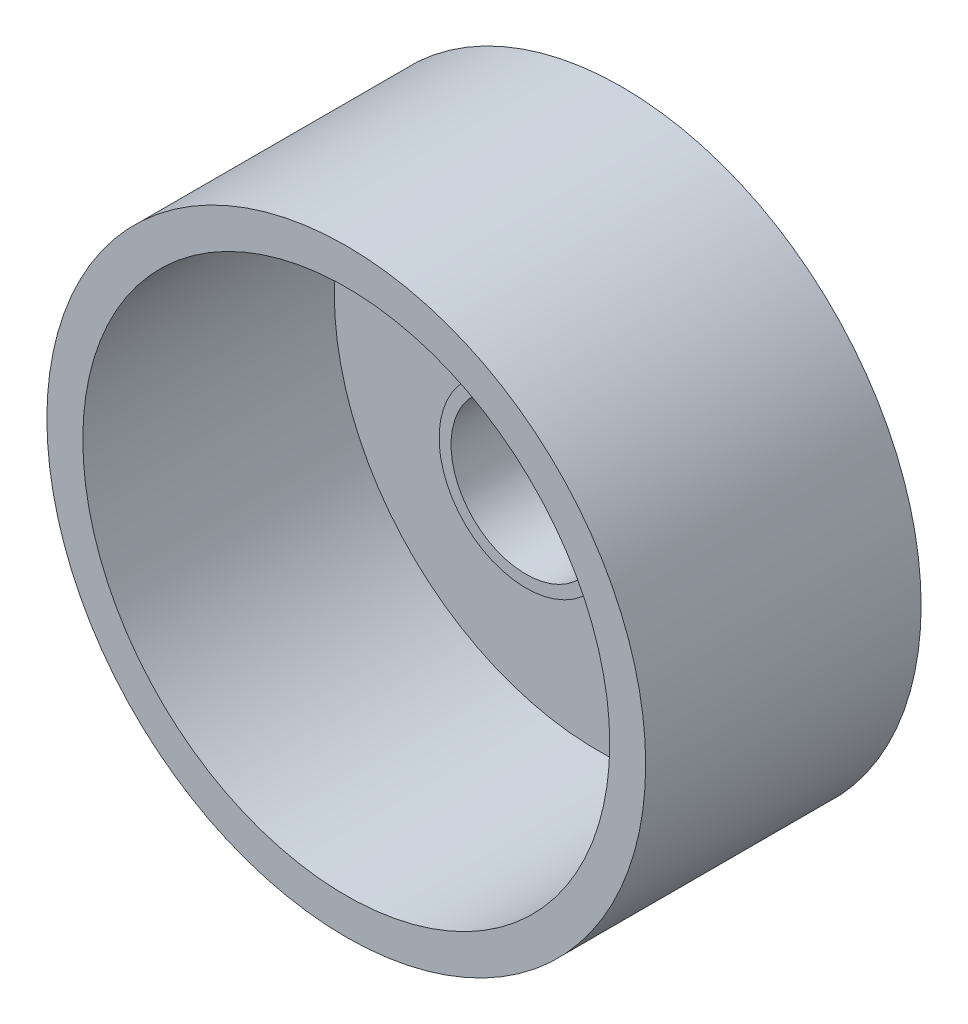
from build123d import *

# Parameters (mm, degrees)
SKETCH_2_R      = 12.5
SKETCH_2_R_2    = 3.125
EXTRUDE_1_DEPTH = 1
SKETCH_2_4_R    = 3.625
SKETCH_2_4_R_2  = 3.125
EXTRUDE_2_DEPTH = 4
SKETCH_2_6_R    = 12.5
SKETCH_2_6_R_2  = 11
EXTRUDE_3_DEPTH = 11.5


with BuildPart() as part:
    # ｽｹｯﾁ2 → ﾎﾞｽ - 押し出し1 (new body)
    with BuildSketch(Plane.XY):
        Circle(SKETCH_2_R)
        Circle(SKETCH_2_R_2, mode=Mode.SUBTRACT)
    extrude(amount=EXTRUDE_1_DEPTH)

    # ｽｹｯﾁ2<4> → ﾎﾞｽ - 押し出し2 (add)
    with BuildSketch(Plane.XY):
        Circle(SKETCH_2_4_R)
        Circle(SKETCH_2_4_R_2, mode=Mode.SUBTRACT)
    extrude(amount=EXTRUDE_2_DEPTH)

    # ｽｹｯﾁ2<6> → ﾎﾞｽ - 押し出し3 (add)
    with BuildSketch(Plane.XY):
        Circle(SKETCH_2_6_R)
        Circle(SKETCH_2_6_R_2, mode=Mode.SUBTRACT)
    extrude(amount=EXTRUDE_3_DEPTH)


solid = part.part
